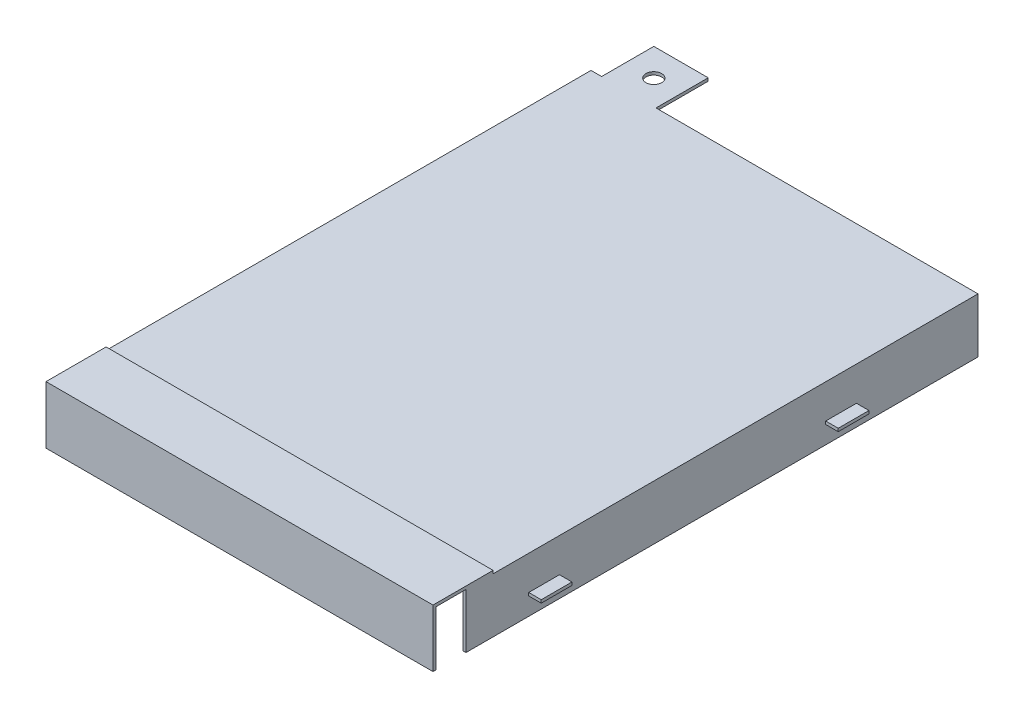
from build123d import *

# Parameters (mm, degrees)
SKETCH_1_W          = 71.15
SKETCH_1_H          = 94.15
EXTRUDE_1_DEPTH     = 0.55
SKETCH_2_W          = 0.55
SKETCH_2_H          = 94.15
EXTRUDE_2_DEPTH     = 9.5
SKETCH_3_W          = 10
SKETCH_3_H          = 9.6
EXTRUDE_3_DEPTH     = 0.55
SKETCH_4_R          = 1.45
CUT_EXTRUDE_1_DEPTH = 0.55
EXTRUDE_4_DEPTH     = 71.15
SKETCH_6_W          = 5.65
SKETCH_6_H          = 0.55
EXTRUDE_5_DEPTH     = 2.3


with BuildPart() as part:
    # Эскиз1 → Бобышка-Вытянуть1 (new body)
    with BuildSketch(Plane(origin=(0, 0, 0), x_dir=(1, 0, 0), z_dir=(0, 1, 0))):
        Rectangle(SKETCH_1_W, SKETCH_1_H)
    extrude(amount=EXTRUDE_1_DEPTH)

    # Эскиз2 → Бобышка-Вытянуть2 (add)
    with BuildSketch(Plane.XZ):
        with Locations((-35.3, 0)):
            Rectangle(SKETCH_2_W, SKETCH_2_H)
        with Locations((35.3, 0)):
            Rectangle(SKETCH_2_W, SKETCH_2_H)
    extrude(amount=EXTRUDE_2_DEPTH)

    # Эскиз3 → Бобышка-Вытянуть3 (add)
    with BuildSketch(Plane(origin=(0, 0.55, 0), x_dir=(1, 0, 0), z_dir=(0, 1, 0))):
        with Locations((-28.625, 51.875)):
            Rectangle(SKETCH_3_W, SKETCH_3_H)
    extrude(amount=-EXTRUDE_3_DEPTH)

    # Эскиз4 → Вырез-Вытянуть1 (cut)
    with BuildSketch(Plane(origin=(0, 0.55, 0), x_dir=(1, 0, 0), z_dir=(0, 1, 0))):
        with Locations(Location((-28.575, 51.625, 0), (0, 0, 270))):
            Circle(SKETCH_4_R)
    extrude(amount=-CUT_EXTRUDE_1_DEPTH, mode=Mode.SUBTRACT)

    # Эскиз5 → Бобышка-Вытянуть4 (add)
    with BuildSketch(Plane.ZY.offset(35.575)):
        Polygon((42.075, 0.55), (42.075, 1.1), (53.125, 1.1), (53.125, -9.5), (52.575, -9.5), (52.575, 0.55), align=None)
    extrude(amount=-EXTRUDE_4_DEPTH)

    # Эскиз6 → Бобышка-Вытянуть5 (add)
    with BuildSketch(Plane.ZY.offset(35.575)):
        with Locations((-21.9, -5.975)):
            Rectangle(SKETCH_6_W, SKETCH_6_H)
        with Locations((32.7, -5.975)):
            Rectangle(SKETCH_6_W, SKETCH_6_H)
    extrude_5 = extrude(amount=EXTRUDE_5_DEPTH)

    # Зеркальное отражение1: Бобышка-Вытянуть5 across plane
    add(extrude_5.mirror(Plane(origin=(0, 0, 0), x_dir=(0, 0, 1), z_dir=(1, 0, 0))))


solid = part.part
